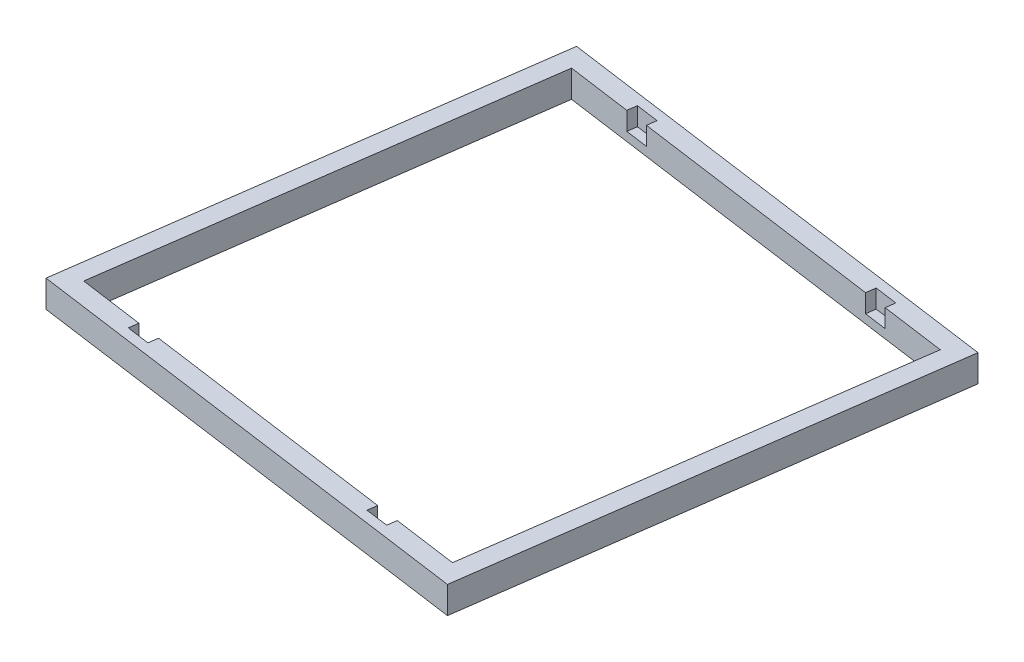
from build123d import *

# Parameters (mm, degrees)
BOSS_EXTRUDE1_DEPTH = 5.08
SKETCH9_W           = 4.318
SKETCH9_H           = 4.318
CUT_EXTRUDE3_DEPTH  = 1.778
SKETCH10_W          = 4.318
SKETCH10_H          = 4.318
CUT_EXTRUDE4_DEPTH  = 1.778
SKETCH11_W          = 4.318
SKETCH11_H          = 4.318
CUT_EXTRUDE5_DEPTH  = 1.778
SKETCH12_W          = 4.318
SKETCH12_H          = 4.318
CUT_EXTRUDE6_DEPTH  = 1.778


with BuildPart() as part:
    # Sketch1 → Boss-Extrude1 (new body)
    with BuildSketch(Plane(origin=(0, 0, 0), x_dir=(1, 0, 0), z_dir=(0, 1, 0))):
        Polygon((-28.91784315, -24.413806508), (-16.791726333, 63.108386813), (-104.313919654, 75.23450363), (-116.440036471, -12.287689691), align=None)
        Polygon((-20.806654289, 60.039384261), (-101.244917102, 71.219575674), (-112.425108515, -9.218687139), (-31.986845702, -20.398878552), align=None, mode=Mode.SUBTRACT)
    extrude(amount=BOSS_EXTRUDE1_DEPTH)

    # Sketch9 → Cut-Extrude3 (cut)
    with BuildSketch(Plane(origin=(-3.387750967, 0, 24.3738942), x_dir=(-0.9904784923139263, 0, -0.13766755704788136), z_dir=(0.13766755704788133, 0, -0.9904784923139262))):
        with Locations((43.18, 3.81)):
            Rectangle(SKETCH9_W, SKETCH9_H)
    extrude(amount=-CUT_EXTRUDE3_DEPTH, mode=Mode.SUBTRACT)

    # Sketch10 → Cut-Extrude4 (cut)
    with BuildSketch(Plane(origin=(7.792440446, 0, -56.064368613), x_dir=(0.9904784923139262, 0, 0.1376675570478817), z_dir=(-0.1376675570478817, 0, 0.9904784923139263))):
        with Locations((-43.18, 3.81)):
            Rectangle(SKETCH10_W, SKETCH10_H)
    extrude(amount=-CUT_EXTRUDE4_DEPTH, mode=Mode.SUBTRACT)

    # Sketch11 → Cut-Extrude5 (cut)
    with BuildSketch(Plane(origin=(7.792440446, 0, -56.064368613), x_dir=(0.9904784923139262, 0, 0.1376675570478817), z_dir=(-0.1376675570478817, 0, 0.9904784923139263))):
        with Locations((-95.758, 3.81)):
            Rectangle(SKETCH11_W, SKETCH11_H)
    extrude(amount=-CUT_EXTRUDE5_DEPTH, mode=Mode.SUBTRACT)

    # Sketch12 → Cut-Extrude6 (cut)
    with BuildSketch(Plane(origin=(-3.387750967, 0, 24.3738942), x_dir=(-0.9904784923139263, 0, -0.13766755704788136), z_dir=(0.13766755704788133, 0, -0.9904784923139262))):
        with Locations((95.758, 3.81)):
            Rectangle(SKETCH12_W, SKETCH12_H)
    extrude(amount=-CUT_EXTRUDE6_DEPTH, mode=Mode.SUBTRACT)


solid = part.part
